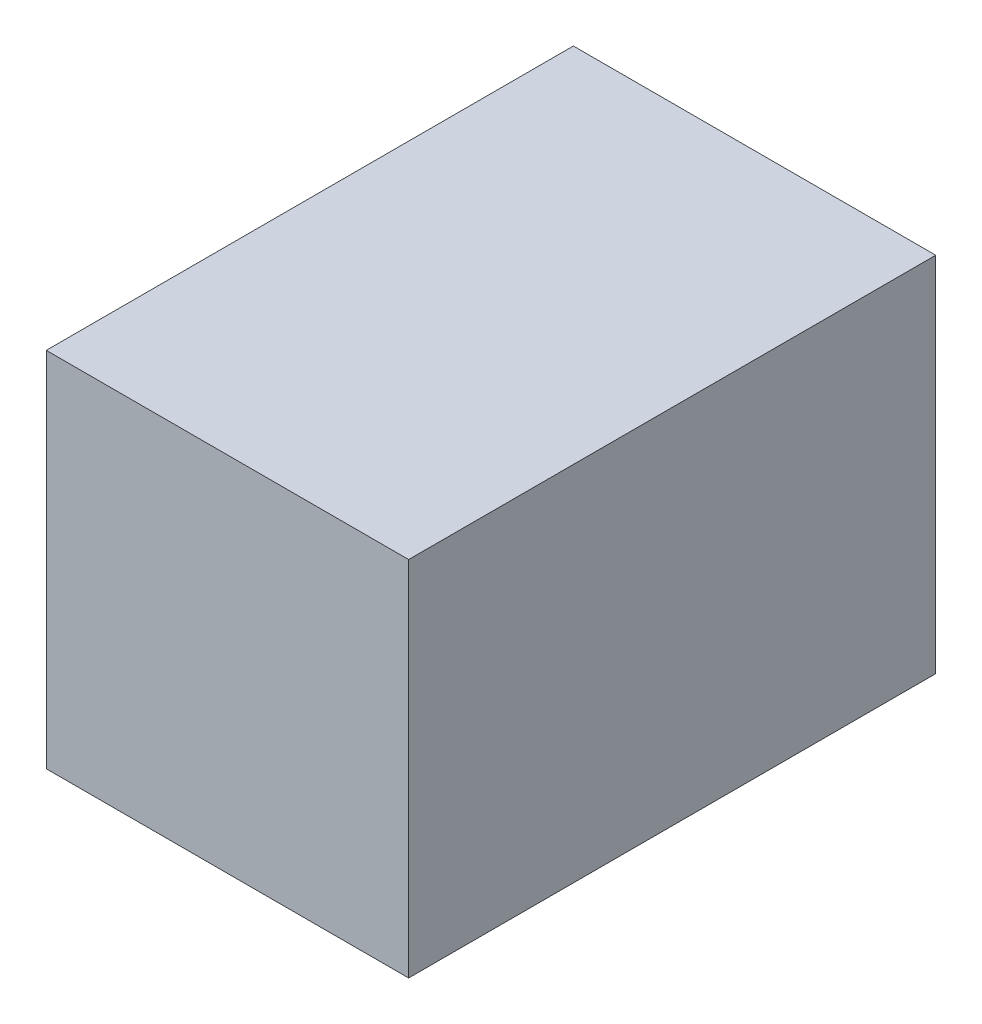
from build123d import *

# Parameters (mm, degrees)
SKETCH1_W           = 27.5
SKETCH1_H           = 27.5
BOSS_EXTRUDE1_DEPTH = 40


with BuildPart() as part:
    # Sketch1 → Boss-Extrude1 (new body)
    with BuildSketch(Plane(origin=(0, 0, 0), x_dir=(0, 1, 0), z_dir=(0, 0, 1))):
        Rectangle(SKETCH1_W, SKETCH1_H)
    extrude(amount=BOSS_EXTRUDE1_DEPTH)


solid = part.part
